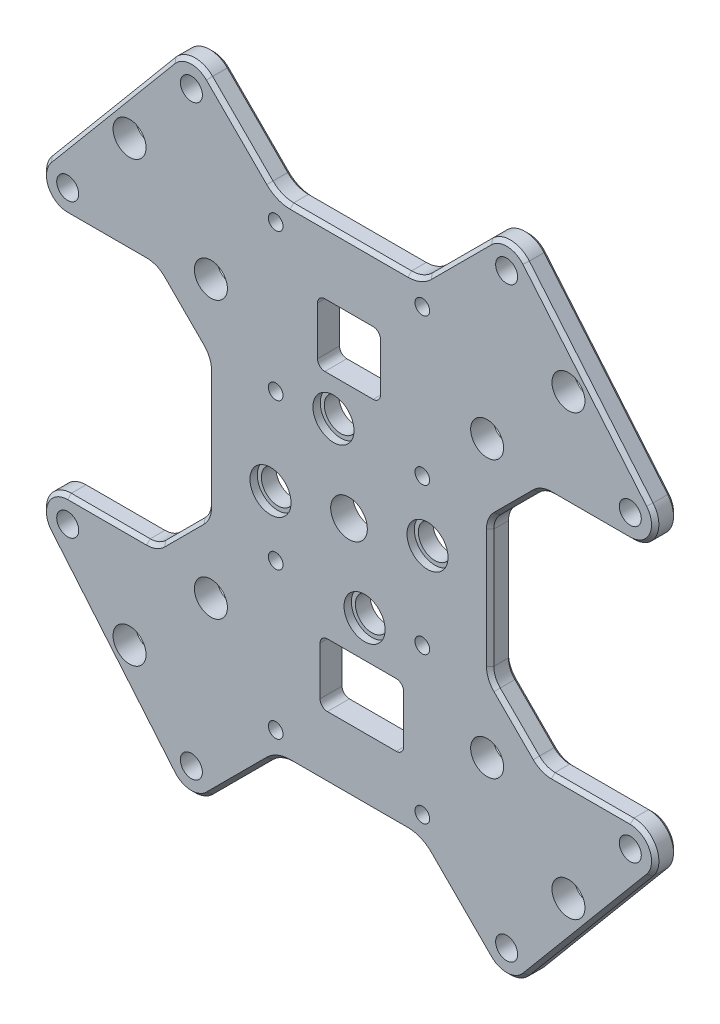
from build123d import *

# Parameters (mm, degrees)
SKETCH_1_R          = 1
SKETCH_1_R_2        = 2.5
SKETCH_1_R_3        = 1.5
EXTRUDE_1_DEPTH     = 3
CHAMFER_1_SIZE      = 0.5
SKETCH_3_R          = 2.25
CUT_EXTRUDE_1_DEPTH = 10
SKETCH_4_R          = 2.8
CUT_EXTRUDE_2_DEPTH = 1


with BuildPart() as part:
    # 草图1 → 凸台-拉伸1 (new body)
    with BuildSketch(Plane.XY):
        with BuildLine():
            Line((-19.095836944, 42.404163056), (-10.863246763, 34.171572875))
            ThreePointArc((-10.863246763, 34.171572875), (-9.565553368, 33.30448187), (-8.034819638, 33))
            Line((-8.034819638, 33), (8.034819638, 33))
            ThreePointArc((8.034819638, 33), (9.565553368, 33.30448187), (10.863246763, 34.171572875))
            Line((10.863246763, 34.171572875), (19.095836944, 42.404163056))
            ThreePointArc((19.095836944, 42.404163056), (21.649591792, 43.396707567), (24.106205037, 42.183505279))
            Line((24.106205037, 42.183505279), (40.973549821, 22.050850063))
            ThreePointArc((40.973549821, 22.050850063), (41.448247083, 18.429276279), (38.367344784, 16.467344784))
            Line((38.367344784, 16.467344784), (27.609480408, 16.467344784))
            ThreePointArc((27.609480408, 16.467344784), (26.461430111, 16.238983382), (25.488160064, 15.588665128))
            Line((25.488160064, 15.588665128), (20.128679656, 10.22918472))
            ThreePointArc((20.128679656, 10.22918472), (19.478361402, 9.255914673), (19.25, 8.107864376))
            Line((19.25, 8.107864376), (19.25, -8.107864376))
            ThreePointArc((19.25, -8.107864376), (19.478361402, -9.255914673), (20.128679656, -10.22918472))
            Line((20.128679656, -10.22918472), (25.488160064, -15.588665128))
            ThreePointArc((25.488160064, -15.588665128), (26.461430111, -16.238983382), (27.609480408, -16.467344784))
            Line((27.609480408, -16.467344784), (38.367344784, -16.467344784))
            ThreePointArc((38.367344784, -16.467344784), (41.448247083, -18.429276279), (40.973549821, -22.050850063))
            Line((40.973549821, -22.050850063), (24.106205037, -42.183505279))
            ThreePointArc((24.106205037, -42.183505279), (21.649591792, -43.396707567), (19.095836944, -42.404163056))
            Line((19.095836944, -42.404163056), (10.863246763, -34.171572875))
            ThreePointArc((10.863246763, -34.171572875), (9.565553368, -33.30448187), (8.034819638, -33))
            Line((8.034819638, -33), (-8.034819638, -33))
            ThreePointArc((-8.034819638, -33), (-9.565553368, -33.30448187), (-10.863246763, -34.171572875))
            Line((-10.863246763, -34.171572875), (-19.095836944, -42.404163056))
            ThreePointArc((-19.095836944, -42.404163056), (-21.649591792, -43.396707567), (-24.106205037, -42.183505279))
            Line((-24.106205037, -42.183505279), (-40.973549821, -22.050850063))
            ThreePointArc((-40.973549821, -22.050850063), (-41.448247083, -18.429276279), (-38.367344784, -16.467344784))
            Line((-38.367344784, -16.467344784), (-27.609480408, -16.467344784))
            ThreePointArc((-27.609480408, -16.467344784), (-26.461430111, -16.238983382), (-25.488160064, -15.588665128))
            Line((-25.488160064, -15.588665128), (-20.128679656, -10.22918472))
            ThreePointArc((-20.128679656, -10.22918472), (-19.478361402, -9.255914673), (-19.25, -8.107864376))
            Line((-19.25, -8.107864376), (-19.25, 8.107864376))
            ThreePointArc((-19.25, 8.107864376), (-19.478361402, 9.255914673), (-20.128679656, 10.22918472))
            Line((-20.128679656, 10.22918472), (-25.488160064, 15.588665128))
            ThreePointArc((-25.488160064, 15.588665128), (-26.461430111, 16.238983382), (-27.609480408, 16.467344784))
            Line((-27.609480408, 16.467344784), (-38.367344784, 16.467344784))
            ThreePointArc((-38.367344784, 16.467344784), (-41.448247083, 18.429276279), (-40.973549821, 22.050850063))
            Line((-40.973549821, 22.050850063), (-24.106205037, 42.183505279))
            ThreePointArc((-24.106205037, 42.183505279), (-21.649591792, 43.396707567), (-19.095836944, 42.404163056))
        make_face()
        with Locations((10, -10)):
            Circle(SKETCH_1_R, mode=Mode.SUBTRACT)
        with Locations((10, 10)):
            Circle(SKETCH_1_R, mode=Mode.SUBTRACT)
        with Locations((-10, 10)):
            Circle(SKETCH_1_R, mode=Mode.SUBTRACT)
        with Locations((-10, -10)):
            Circle(SKETCH_1_R, mode=Mode.SUBTRACT)
        Circle(SKETCH_1_R_2, mode=Mode.SUBTRACT)
        with Locations((-10, 30)):
            Circle(SKETCH_1_R, mode=Mode.SUBTRACT)
        with Locations((10, 30)):
            Circle(SKETCH_1_R, mode=Mode.SUBTRACT)
        with Locations((10, -30)):
            Circle(SKETCH_1_R, mode=Mode.SUBTRACT)
        with Locations((-10, -30)):
            Circle(SKETCH_1_R, mode=Mode.SUBTRACT)
        with Locations((-38.367344784, -19.867344784)):
            Circle(SKETCH_1_R_3, mode=Mode.SUBTRACT)
        with Locations((-29.933672392, -29.933672392)):
            Circle(SKETCH_1_R_3, mode=Mode.SUBTRACT)
        with Locations((-21.5, -40)):
            Circle(SKETCH_1_R_3, mode=Mode.SUBTRACT)
        with Locations((-10.707106781, -2.121320344)):
            Circle(SKETCH_1_R_3, mode=Mode.SUBTRACT)
        with Locations((2.121320344, -10.707106781)):
            Circle(SKETCH_1_R_3, mode=Mode.SUBTRACT)
        with Locations((10.707106781, 2.121320344)):
            Circle(SKETCH_1_R_3, mode=Mode.SUBTRACT)
        with Locations((-2.121320344, 10.707106781)):
            Circle(SKETCH_1_R_3, mode=Mode.SUBTRACT)
        with Locations((-18.838834765, 18.838834765)):
            Circle(SKETCH_1_R_3, mode=Mode.SUBTRACT)
        with Locations((18.838834765, 18.838834765)):
            Circle(SKETCH_1_R_3, mode=Mode.SUBTRACT)
        with Locations((18.838834765, -18.838834765)):
            Circle(SKETCH_1_R_3, mode=Mode.SUBTRACT)
        with Locations((-18.838834765, -18.838834765)):
            Circle(SKETCH_1_R_3, mode=Mode.SUBTRACT)
        with Locations((-21.5, 40)):
            Circle(SKETCH_1_R_3, mode=Mode.SUBTRACT)
        with Locations((-29.933672392, 29.933672392)):
            Circle(SKETCH_1_R_3, mode=Mode.SUBTRACT)
        with Locations((-38.367344784, 19.867344784)):
            Circle(SKETCH_1_R_3, mode=Mode.SUBTRACT)
        with Locations((21.5, -40)):
            Circle(SKETCH_1_R_3, mode=Mode.SUBTRACT)
        with Locations((29.933672392, -29.933672392)):
            Circle(SKETCH_1_R_3, mode=Mode.SUBTRACT)
        with Locations((38.367344784, -19.867344784)):
            Circle(SKETCH_1_R_3, mode=Mode.SUBTRACT)
        with Locations((38.367344784, 19.867344784)):
            Circle(SKETCH_1_R_3, mode=Mode.SUBTRACT)
        with Locations((29.933672392, 29.933672392)):
            Circle(SKETCH_1_R_3, mode=Mode.SUBTRACT)
        with Locations((21.5, 40)):
            Circle(SKETCH_1_R_3, mode=Mode.SUBTRACT)
        with BuildLine():
            Line((-3.292893219, 24.292893219), (3.292893219, 24.292893219))
            ThreePointArc((3.292893219, 24.292893219), (4, 24), (4.292893219, 23.292893219))
            Line((4.292893219, 23.292893219), (4.292893219, 16.707106781))
            ThreePointArc((4.292893219, 16.707106781), (4, 16), (3.292893219, 15.707106781))
            Line((3.292893219, 15.707106781), (-3.292893219, 15.707106781))
            ThreePointArc((-3.292893219, 15.707106781), (-4, 16), (-4.292893219, 16.707106781))
            Line((-4.292893219, 16.707106781), (-4.292893219, 23.292893219))
            ThreePointArc((-4.292893219, 23.292893219), (-4, 24), (-3.292893219, 24.292893219))
        make_face(mode=Mode.SUBTRACT)
        with BuildLine():
            Line((-2.946339079, -15.707106781), (6.446339079, -15.707106781))
            ThreePointArc((6.446339079, -15.707106781), (7.15344586, -16), (7.446339079, -16.707106781))
            Line((7.446339079, -16.707106781), (7.446339079, -23.292893219))
            ThreePointArc((7.446339079, -23.292893219), (7.15344586, -24), (6.446339079, -24.292893219))
            Line((6.446339079, -24.292893219), (-2.946339079, -24.292893219))
            ThreePointArc((-2.946339079, -24.292893219), (-3.65344586, -24), (-3.946339079, -23.292893219))
            Line((-3.946339079, -23.292893219), (-3.946339079, -16.707106781))
            ThreePointArc((-3.946339079, -16.707106781), (-3.65344586, -16), (-2.946339079, -15.707106781))
        make_face(mode=Mode.SUBTRACT)
    extrude(amount=EXTRUDE_1_DEPTH)

    # 倒角1
    chamfer_1_edges = [part.edges().sort_by_distance(p)[0] for p in [
        (32.539877429, -32.117177671, 3),
        (41.448247083, -18.429276279, 3),
        (32.988412596, -16.467344784, 3),
        (-19.25, 0, 0),
        (26.461430111, -16.238983382, 3),
        (-19.478361402, 9.255914673, 0),
        (-22.80841986, 12.908924924, 0),
        (-26.461430111, 16.238983382, 0),
        (-32.988412596, 16.467344784, 0),
        (-41.448247083, 18.429276279, 0),
        (-32.539877429, 32.117177671, 0),
        (-21.649591792, 43.396707567, 0),
        (-14.979541854, 38.287867966, 0),
        (-9.565553368, 33.30448187, 0),
        (0, 33, 0),
        (22.80841986, -12.908924924, 3),
        (9.565553368, 33.30448187, 0),
        (14.979541854, 38.287867966, 0),
        (21.649591792, 43.396707567, 0),
        (32.539877429, 32.117177671, 0),
        (41.448247083, 18.429276279, 0),
        (32.988412596, 16.467344784, 0),
        (26.461430111, 16.238983382, 0),
        (22.80841986, 12.908924924, 0),
        (19.478361402, 9.255914673, 0),
        (19.25, 0, 0),
        (19.478361402, -9.255914673, 3),
        (19.478361402, -9.255914673, 0),
        (22.80841986, -12.908924924, 0),
        (26.461430111, -16.238983382, 0),
        (32.988412596, -16.467344784, 0),
        (41.448247083, -18.429276279, 0),
        (32.539877429, -32.117177671, 0),
        (21.649591792, -43.396707567, 0),
        (14.979541854, -38.287867966, 0),
        (9.565553368, -33.30448187, 0),
        (0, -33, 0),
        (19.25, 0, 3),
        (-9.565553368, -33.30448187, 0),
        (-14.979541854, -38.287867966, 0),
        (-21.649591792, -43.396707567, 0),
        (-32.539877429, -32.117177671, 0),
        (-41.448247083, -18.429276279, 0),
        (-32.988412596, -16.467344784, 0),
        (-26.461430111, -16.238983382, 0),
        (-22.80841986, -12.908924924, 0),
        (-19.478361402, -9.255914673, 0),
        (19.478361402, 9.255914673, 3),
        (22.80841986, 12.908924924, 3),
        (26.461430111, 16.238983382, 3),
        (32.988412596, 16.467344784, 3),
        (41.448247083, 18.429276279, 3),
        (32.539877429, 32.117177671, 3),
        (21.649591792, 43.396707567, 3),
        (14.979541854, 38.287867966, 3),
        (9.565553368, 33.30448187, 3),
        (0, 33, 3),
        (-9.565553368, 33.30448187, 3),
        (-14.979541854, 38.287867966, 3),
        (-21.649591792, 43.396707567, 3),
        (-32.539877429, 32.117177671, 3),
        (-41.448247083, 18.429276279, 3),
        (-32.988412596, 16.467344784, 3),
        (-26.461430111, 16.238983382, 3),
        (-22.80841986, 12.908924924, 3),
        (-19.478361402, 9.255914673, 3),
        (-19.25, 0, 3),
        (-19.478361402, -9.255914673, 3),
        (-22.80841986, -12.908924924, 3),
        (-26.461430111, -16.238983382, 3),
        (-32.988412596, -16.467344784, 3),
        (-41.448247083, -18.429276279, 3),
        (-32.539877429, -32.117177671, 3),
        (-21.649591792, -43.396707567, 3),
        (-14.979541854, -38.287867966, 3),
        (-9.565553368, -33.30448187, 3),
        (0, -33, 3),
        (9.565553368, -33.30448187, 3),
        (14.979541854, -38.287867966, 3),
        (21.649591792, -43.396707567, 3),
    ]]
    chamfer(chamfer_1_edges, length=CHAMFER_1_SIZE)

    # 草图3 → 切除-拉伸1 (cut)
    with BuildSketch(Plane.XY.offset(3)):
        with Locations((-2.121320344, 10.707106781)):
            Circle(SKETCH_3_R)
        with Locations((10.707106781, 2.121320344)):
            Circle(SKETCH_3_R)
        with Locations((2.121320344, -10.707106781)):
            Circle(SKETCH_3_R)
        with Locations((-10.707106781, -2.121320344)):
            Circle(SKETCH_3_R)
        with Locations((18.838834765, 18.838834765)):
            Circle(SKETCH_3_R)
        with Locations((29.933672392, 29.933672392)):
            Circle(SKETCH_3_R)
        with Locations((-29.933672392, 29.933672392)):
            Circle(SKETCH_3_R)
        with Locations((-18.838834765, 18.838834765)):
            Circle(SKETCH_3_R)
        with Locations((-18.838834765, -18.838834765)):
            Circle(SKETCH_3_R)
        with Locations((-29.933672392, -29.933672392)):
            Circle(SKETCH_3_R)
        with Locations((18.838834765, -18.838834765)):
            Circle(SKETCH_3_R)
        with Locations((29.933672392, -29.933672392)):
            Circle(SKETCH_3_R)
    extrude(amount=-CUT_EXTRUDE_1_DEPTH, mode=Mode.SUBTRACT)

    # 草图4 → 切除-拉伸2 (cut)
    with BuildSketch(Plane.XY.offset(3)):
        with Locations((-2.121320344, 10.707106781)):
            Circle(SKETCH_4_R)
        with Locations((10.707106781, 2.121320344)):
            Circle(SKETCH_4_R)
        with Locations((-10.707106781, -2.121320344)):
            Circle(SKETCH_4_R)
        with Locations((2.121320344, -10.707106781)):
            Circle(SKETCH_4_R)
    extrude(amount=-CUT_EXTRUDE_2_DEPTH, mode=Mode.SUBTRACT)


solid = part.part
